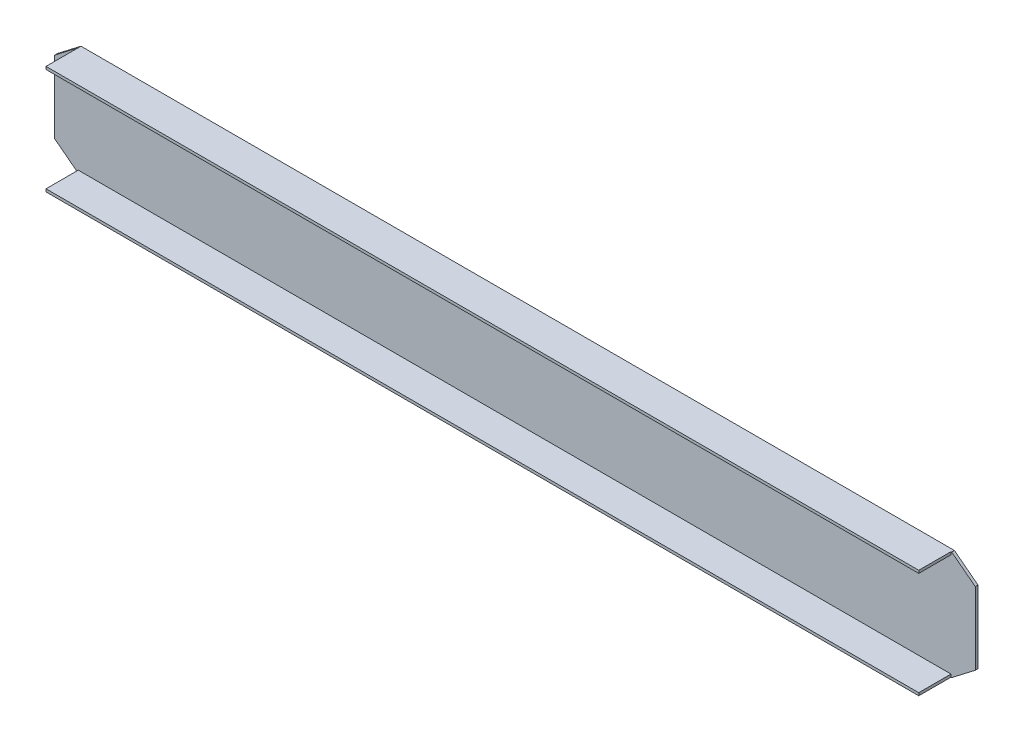
from build123d import *

# Parameters (mm, degrees)
EXTRUDE_589_DEPTH = 7.5
SKETCH_2_W        = 2408.049034164
SKETCH_2_H        = 7.5
EXTRUDE_1_DEPTH   = 89
SKETCH_3_W        = 80
SKETCH_3_H        = 240
EXTRUDE_2_DEPTH   = 16


with BuildPart() as part:
    # 草图1 → Extrude 589 (new body)
    with BuildSketch(Plane.XY):
        Polygon((-1205, 0), (1205, 0), (1270, 50), (1270, 250), (1205, 300), (-1205, 300), (-1270, 250), (-1270, 50), align=None)
    extrude(amount=-EXTRUDE_589_DEPTH)

    # 草图2 → 凸台-拉伸1 (add)
    with BuildSketch(Plane.XY):
        with Locations((-0.975482918, 296.25)):
            Rectangle(SKETCH_2_W, SKETCH_2_H)
        with Locations((-0.975482918, 3.75)):
            Rectangle(SKETCH_2_W, SKETCH_2_H)
    extrude(amount=EXTRUDE_1_DEPTH)

    # 草图3 → 凸台-拉伸2 (add)
    with BuildSketch(Plane(origin=(0, 0, -7.5), x_dir=(-1, 0, 0), z_dir=(0, 0, -1))):
        with Locations((-580, 150)):
            Rectangle(SKETCH_3_W, SKETCH_3_H)
        with Locations((-180, 150)):
            Rectangle(SKETCH_3_W, SKETCH_3_H)
        with Locations((180, 150)):
            Rectangle(SKETCH_3_W, SKETCH_3_H)
        with Locations((580, 150)):
            Rectangle(SKETCH_3_W, SKETCH_3_H)
    extrude(amount=EXTRUDE_2_DEPTH)


solid = part.part
